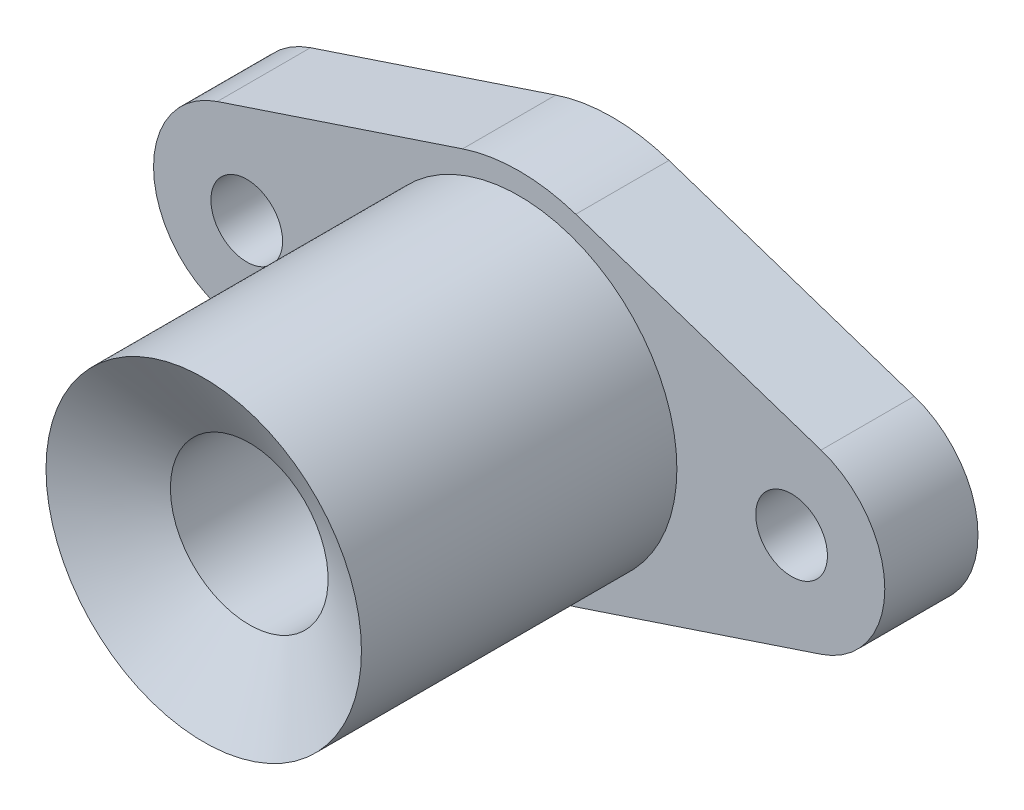
from build123d import *

# Parameters (mm, degrees)
SCHIZZO2_R                   = 5
ESTRUSIONE_ESTRUSIONE1_DEPTH = 13
SCHIZZO3_R                   = 22
ESTRUSIONE_ESTRUSIONE2_DEPTH = 44


with BuildPart() as part:
    # Schizzo2 → Estrusione-Estrusione1 (new body)
    with BuildSketch(Plane.XY):
        with BuildLine():
            Line((-42.105263158, 12.334780679), (-7.894736842, 23.720732075))
            ThreePointArc((-7.894736842, 23.720732075), (0, 25), (7.894736842, 23.720732075))
            Line((7.894736842, 23.720732075), (42.105263158, 12.334780679))
            ThreePointArc((42.105263158, 12.334780679), (51, 0), (42.105263158, -12.334780679))
            Line((42.105263158, -12.334780679), (7.894736842, -23.720732075))
            ThreePointArc((7.894736842, -23.720732075), (0, -25), (-7.894736842, -23.720732075))
            Line((-7.894736842, -23.720732075), (-42.105263158, -12.334780679))
            ThreePointArc((-42.105263158, -12.334780679), (-51, 0), (-42.105263158, 12.334780679))
        make_face()
        with Locations((38, 0)):
            Circle(SCHIZZO2_R, mode=Mode.SUBTRACT)
        with Locations((-38, 0)):
            Circle(SCHIZZO2_R, mode=Mode.SUBTRACT)
    extrude(amount=-ESTRUSIONE_ESTRUSIONE1_DEPTH)

    # Schizzo3 → Estrusione-Estrusione2 (add)
    with BuildSketch(Plane.XY):
        Circle(SCHIZZO3_R)
    extrude(amount=ESTRUSIONE_ESTRUSIONE2_DEPTH)

    # Schizzo5 → Taglia-Rivoluzione2 (revolve, cut)
    with BuildSketch(Plane(origin=(0, 0, 0), x_dir=(1, 0, 0), z_dir=(0, 1, 0))):
        Polygon((0, 13), (-11, 13), (-11, -37.649147039), (-22, -44), (0, -44), align=None)
    revolve(axis=Axis((0, 0, -13), (0, 0, 1)), mode=Mode.SUBTRACT)


solid = part.part
